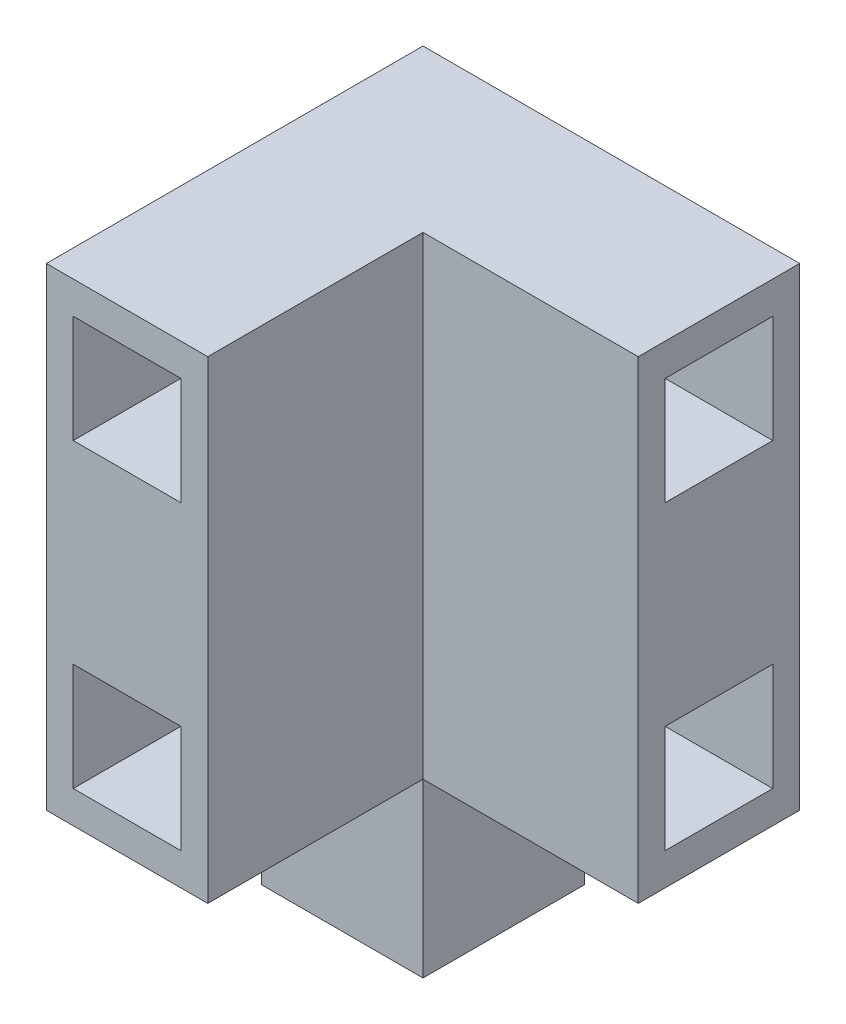
from build123d import *

# Parameters (mm, degrees)
SKETCH_1_W          = 15
SKETCH_1_H          = 15
EXTRUDE_1_DEPTH     = 60
SKETCH_4_W          = 15
SKETCH_4_H          = 44
EXTRUDE_4_DEPTH     = 20
SKETCH_5_W          = 15
SKETCH_5_H          = 44
EXTRUDE_5_DEPTH     = 20
SKETCH_6_W          = 10
SKETCH_6_H          = 10
CUT_EXTRUDE_1_DEPTH = 70
SKETCH_7_W          = 10
SKETCH_7_H          = 10
CUT_EXTRUDE_2_DEPTH = 70


with BuildPart() as part:
    # 草图1 → 凸台-拉伸1 (new body)
    with BuildSketch(Plane(origin=(0, 0, 0), x_dir=(1, 0, 0), z_dir=(0, 1, 0))):
        Rectangle(SKETCH_1_W, SKETCH_1_H)
    extrude(amount=EXTRUDE_1_DEPTH)

    # 草图4 → 凸台-拉伸4 (add)
    with BuildSketch(Plane.XY.offset(7.5)):
        with Locations((0, 38)):
            Rectangle(SKETCH_4_W, SKETCH_4_H)
    extrude(amount=EXTRUDE_4_DEPTH)

    # 草图5 → 凸台-拉伸5 (add)
    with BuildSketch(Plane(origin=(7.5, 0, 0), x_dir=(0, 0, -1), z_dir=(1, 0, 0))):
        with Locations((0, 38)):
            Rectangle(SKETCH_5_W, SKETCH_5_H)
    extrude(amount=EXTRUDE_5_DEPTH)

    # 草图6 → 切除-拉伸1 (cut)
    with BuildSketch(Plane.XY.offset(27.5)):
        with Locations((0, 52)):
            Rectangle(SKETCH_6_W, SKETCH_6_H)
        with Locations((0, 24)):
            Rectangle(SKETCH_6_W, SKETCH_6_H)
    extrude(amount=-CUT_EXTRUDE_1_DEPTH, mode=Mode.SUBTRACT)

    # 草图7 → 切除-拉伸2 (cut)
    with BuildSketch(Plane(origin=(27.5, 0, 0), x_dir=(0, 0, -1), z_dir=(1, 0, 0))):
        with Locations((0, 52)):
            Rectangle(SKETCH_7_W, SKETCH_7_H)
        with Locations((0, 24)):
            Rectangle(SKETCH_7_W, SKETCH_7_H)
    extrude(amount=-CUT_EXTRUDE_2_DEPTH, mode=Mode.SUBTRACT)


solid = part.part
